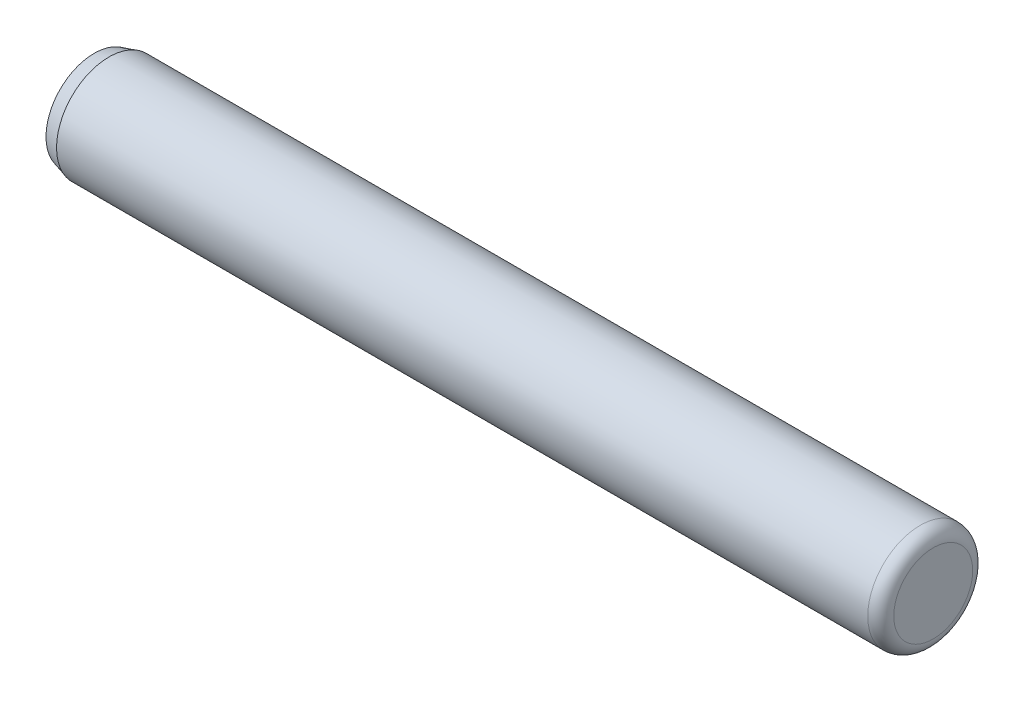
from build123d import *


with BuildPart() as part:
    # Sketch3 → Revolve1 (revolve)
    with BuildSketch(Plane.XY, mode=Mode.PRIVATE) as revolve1_sk:
        with BuildLine():
            Line((25.4, 2.39014), (25.4, 0))
            Line((25.4, 0), (-25.4, 0))
            Line((-25.4, 0), (-25.4, 2.921))
            Line((-25.4, 2.921), (-24.505338699, 3.17754))
            Line((-24.505338699, 3.17754), (24.6126, 3.17754))
            ThreePointArc((24.6126, 3.17754), (25.16937588, 2.94691588), (25.4, 2.39014))
        make_face()
    revolve(revolve1_sk.sketch.rotate(Axis((-25.4, 0, 0), (1, 0, 0)), 90), axis=Axis((-25.4, 0, 0), (1, 0, 0)))


solid = part.part
